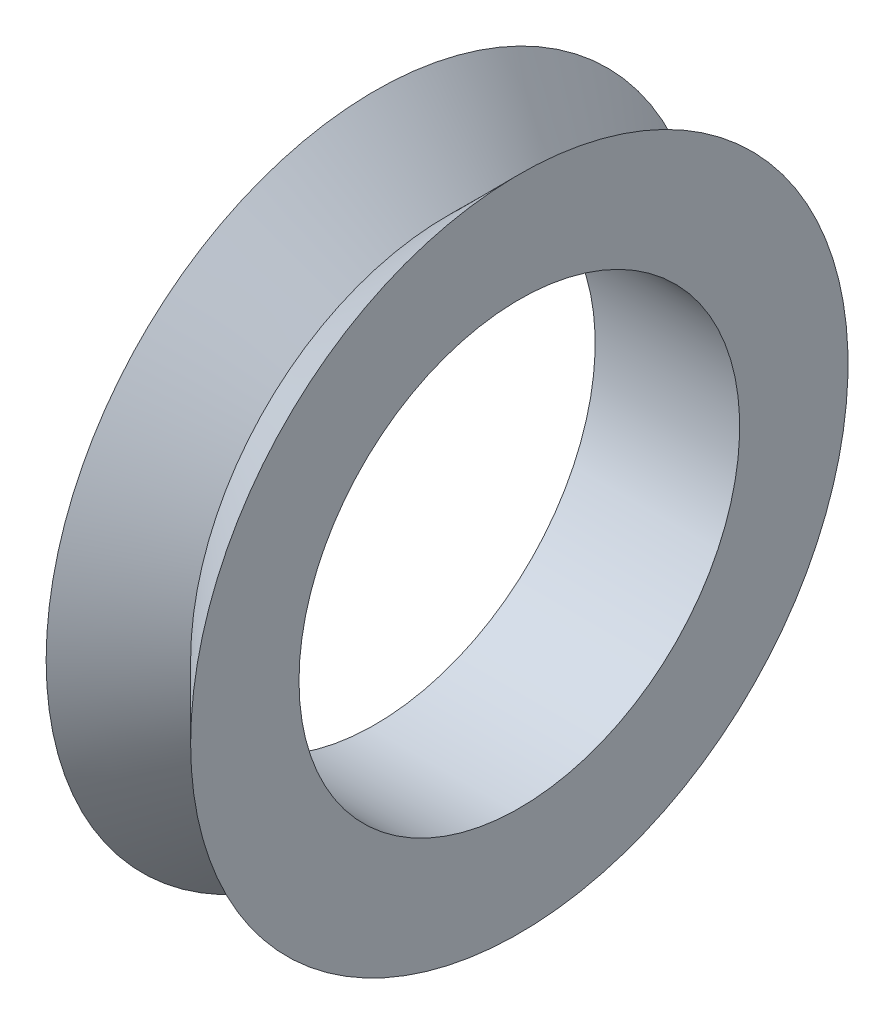
from build123d import *


with BuildPart() as part:
    # Sketch5 → Revolve4 (revolve)
    with BuildSketch(Plane.XY, mode=Mode.PRIVATE) as revolve4_sk:
        Polygon((-2, 6.1), (2, 6.1), (2, 9.1), (0, 7.1), (-2, 9.1), align=None)
    revolve(revolve4_sk.sketch.rotate(Axis((-6.924078091, 0, 0), (1, 0, 0)), 90), axis=Axis((-6.924078091, 0, 0), (1, 0, 0)))


solid = part.part
